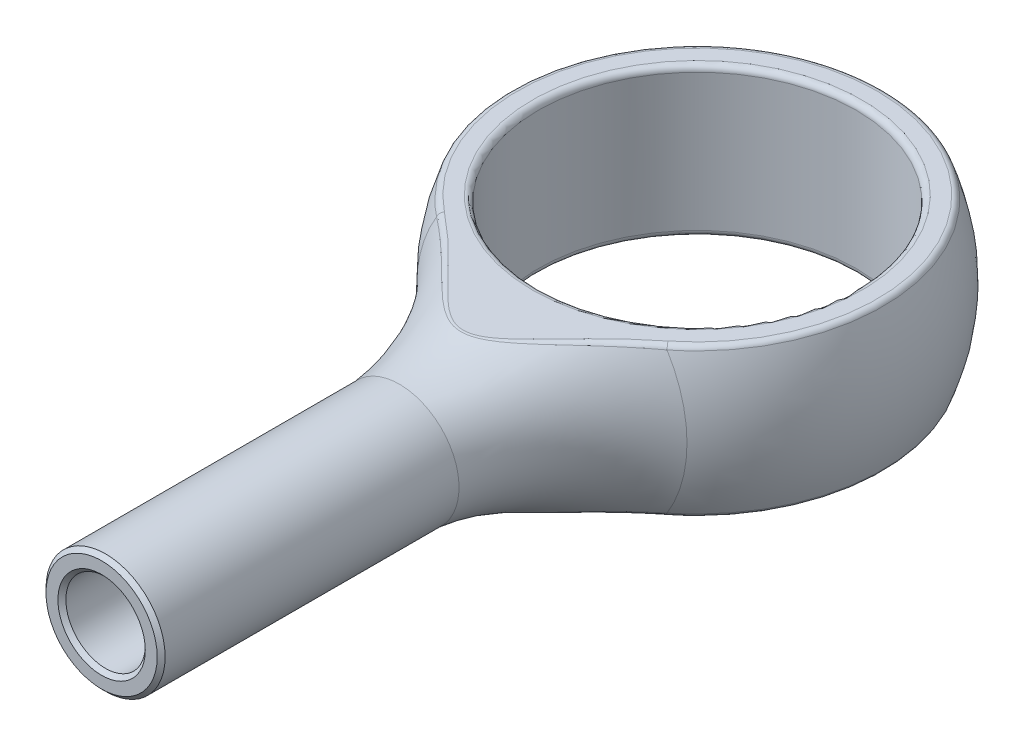
from build123d import *

# Parameters (mm, degrees)
CUT_EXTRUDE1_DEPTH      = 10
CUT_EXTRUDE1_DEPTH_BACK = 10
CUT_EXTRUDE2_DEPTH      = 10
CUT_EXTRUDE2_DEPTH_BACK = 10
SKETCH4_R               = 4
FILLET1_R               = 0.15
SKETCH5_R               = 1
CUT_EXTRUDE3_DEPTH      = 5
CHAMFER1_SIZE           = 0.1


with BuildPart() as part:
    # Sketch2 → Revolve1 (revolve)
    with BuildSketch(Plane(origin=(0, 0, 0), x_dir=(1, 0, 0), z_dir=(0, 1, 0))):
        with BuildLine():
            Line((-1.5, -15), (0, -15))
            Line((0, -15), (0, 5))
            ThreePointArc((0, 5), (-4.653678795, 1.828462107), (-3.403630134, -3.662690529))
            ThreePointArc((-3.403630134, -3.662690529), (-2.101159156, -5.407390267), (-1.5, -7.5))
            Line((-1.5, -7.5), (-1.5, -15))
        make_face()
    revolve(axis=Axis((0, 0, -5), (0, 0, 1)))

    # Sketch3 → Cut-Extrude1 (cut, two sides: drawn at the far end of the back side and taken through both)
    with BuildSketch(Plane(origin=(0, 0, 0), x_dir=(0, 0, -1), z_dir=(1, 0, 0)).offset(-CUT_EXTRUDE1_DEPTH_BACK)):
        with BuildLine():
            Line((-28.551214251, 11.477133286), (8.27443741, 11.477133286))
            Line((8.27443741, 11.477133286), (8.27443741, 1.875))
            Line((8.27443741, 1.875), (-13.261452794, 1.875))
            ThreePointArc((-13.261452794, 1.875), (-14.764981791, 2.106415246), (-16.129334975, 2.779239779))
            Line((-16.129334975, 2.779239779), (-28.551214251, 11.477133286))
        make_face()
        with BuildLine():
            Line((-16.129334975, -2.779239779), (-28.551214251, -11.477133286))
            Line((-28.551214251, -11.477133286), (8.27443741, -11.477133286))
            Line((8.27443741, -11.477133286), (8.27443741, -1.875))
            Line((8.27443741, -1.875), (-13.261452794, -1.875))
            ThreePointArc((-13.261452794, -1.875), (-14.764981791, -2.106415246), (-16.129334975, -2.779239779))
        make_face()
    extrude(amount=CUT_EXTRUDE1_DEPTH + CUT_EXTRUDE1_DEPTH_BACK, mode=Mode.SUBTRACT)

    # Sketch4 → Cut-Extrude2 (cut, two sides: drawn at the far end of the back side and taken through both)
    with BuildSketch(Plane(origin=(0, 0, 0), x_dir=(1, 0, 0), z_dir=(0, 1, 0)).offset(-CUT_EXTRUDE2_DEPTH_BACK)):
        Circle(SKETCH4_R)
    extrude(amount=CUT_EXTRUDE2_DEPTH + CUT_EXTRUDE2_DEPTH_BACK, mode=Mode.SUBTRACT)

    # Fillet1
    fillet1_edges = [part.edges().sort_by_distance(p)[0] for p in [
        (-4, -1.875, 0),
        (0, -1.875, -4.635124054),
        (0, 1.875, -4.635124054),
        (-1e-09, -1.875, 5.921985494),
        (1e-09, 1.875, 5.921985494),
        (-4, 1.875, 0),
    ]]
    fillet(fillet1_edges, radius=FILLET1_R)

    # Sketch5 → Cut-Extrude3 (cut)
    with BuildSketch(Plane.XY.offset(15)):
        Circle(SKETCH5_R)
    extrude(amount=-CUT_EXTRUDE3_DEPTH, mode=Mode.SUBTRACT)

    # Chamfer1
    chamfer1_edges = [part.edges().sort_by_distance(p)[0] for p in [
        (1.5, 0, 15),
        (-1, 0, 15),
    ]]
    chamfer(chamfer1_edges, length=CHAMFER1_SIZE)


solid = part.part
